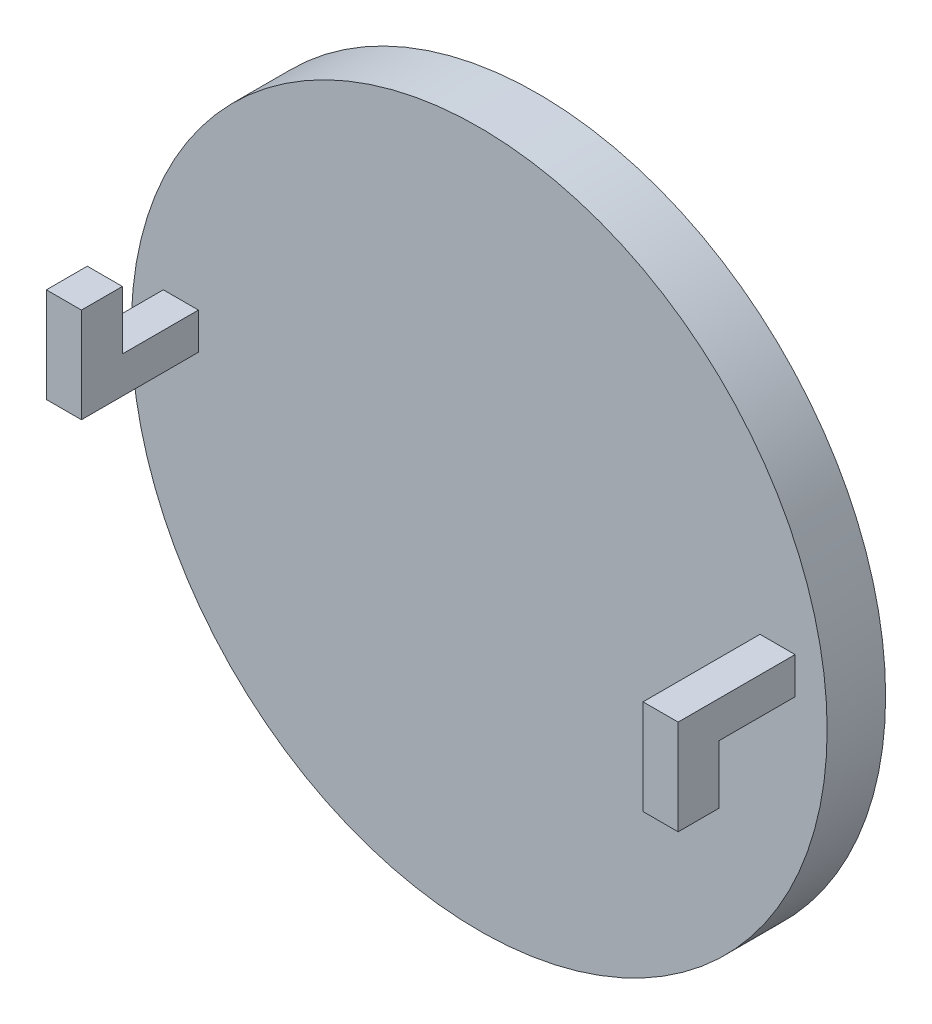
from build123d import *

# Parameters (mm, degrees)
SKETCH1_R           = 11.9
BOSS_EXTRUDE1_DEPTH = 2
SKETCH2_W           = 1.2
SKETCH2_H           = 1.25
BOSS_EXTRUDE2_DEPTH = 4
SKETCH3_W           = 1.2
SKETCH3_H           = 1.4
BOSS_EXTRUDE3_DEPTH = 2
SKETCH4_W           = 1.2
SKETCH4_H           = 1.4
BOSS_EXTRUDE4_DEPTH = 2


with BuildPart() as part:
    # Sketch1 → Boss-Extrude1 (new body)
    with BuildSketch(Plane.XY):
        Circle(SKETCH1_R)
    extrude(amount=BOSS_EXTRUDE1_DEPTH)

    # Sketch2 → Boss-Extrude2 (add)
    with BuildSketch(Plane.XY.offset(2)):
        with Locations((10.203511987, 1.056286149)):
            Rectangle(SKETCH2_W, SKETCH2_H)
        with Locations((-10.203511987, 1.056286149)):
            Rectangle(SKETCH2_W, SKETCH2_H)
    extrude(amount=BOSS_EXTRUDE2_DEPTH)

    # Sketch3 → Boss-Extrude3 (add)
    with BuildSketch(Plane(origin=(0, 1.681286149, 0), x_dir=(1, 0, 0), z_dir=(0, 1, 0))):
        with Locations((-10.203511987, -5.3)):
            Rectangle(SKETCH3_W, SKETCH3_H)
    extrude(amount=BOSS_EXTRUDE3_DEPTH)

    # Sketch4 → Boss-Extrude4 (add)
    with BuildSketch(Plane.XZ.offset(-0.431286149)):
        with Locations((10.203511987, 5.3)):
            Rectangle(SKETCH4_W, SKETCH4_H)
    extrude(amount=BOSS_EXTRUDE4_DEPTH)


solid = part.part
